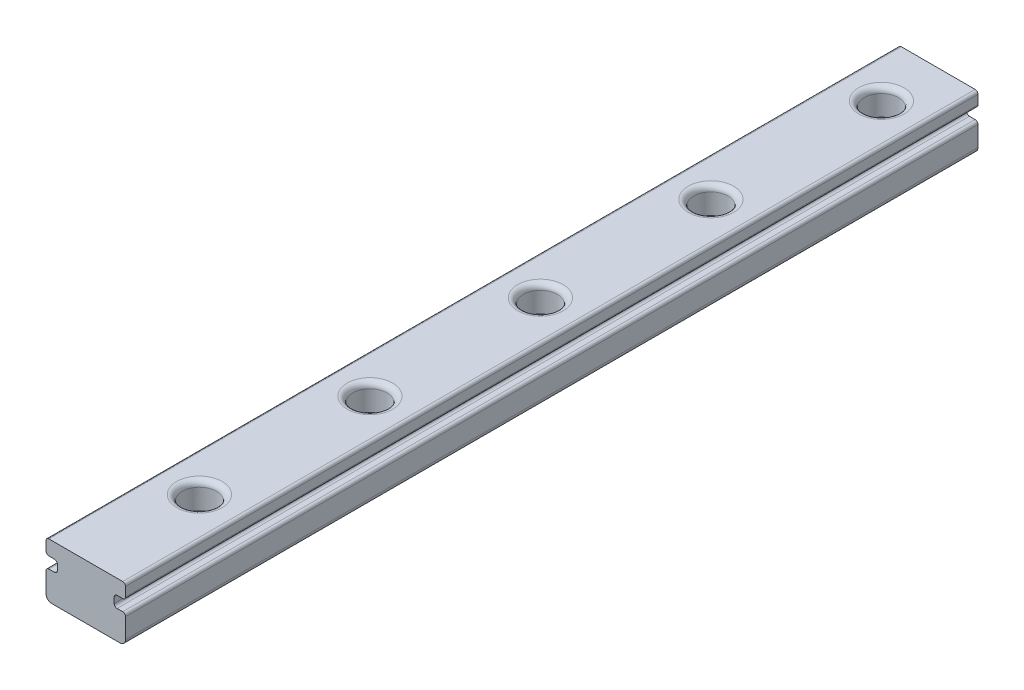
from build123d import *

# Parameters (mm, degrees)
EXTRUDE_1_DEPTH                = 85
FILLET_1_R                     = 0.25
FILLET_2_R                     = 0.5
SKETCH_2_R                     = 1.5
CUT_EXTRUDE_1_DEPTH            = 2.3
SKETCH_3_R                     = 1.2
CUT_EXTRUDE_2_DEPTH            = 86.324381041
FILLET_3_R                     = 0.5
PATTERN_LINEAR_2_COUNT         = 6
PATTERN_LINEAR_2_PITCH         = 15
FILLET_3_OF_PATTERN_LINEAR_2_R = 0.5
SKETCH_4_W                     = 7
SKETCH_4_H                     = 10
CUT_EXTRUDE_3_DEPTH            = 86.422713607


with BuildPart() as part:
    # 草图1 → 凸台-拉伸1 (new body)
    with BuildSketch(Plane.XY):
        Polygon((0, 2.5), (0, 0), (7, 0), (7, 2.5), (6, 2.5), (6, 3.5), (7, 3.5), (7, 4.8), (0, 4.8), (0, 3.5), (1, 3.5), (1, 2.5), align=None)
    extrude(amount=EXTRUDE_1_DEPTH)

    # 圆角1
    fillet_1_edges = [part.edges().sort_by_distance(p)[0] for p in [
        (7, 2.5, 42.5),
        (0, 2.5, 42.5),
        (1, 3.5, 42.5),
        (1, 2.5, 42.5),
        (6, 2.5, 42.5),
        (6, 3.5, 42.5),
        (7, 4.8, 42.5),
        (0, 4.8, 42.5),
        (0, 3.5, 42.5),
        (7, 3.5, 42.5),
    ]]
    fillet(fillet_1_edges, radius=FILLET_1_R)

    # 圆角2
    fillet_2_edges = [part.edges().sort_by_distance(p)[0] for p in [
        (0, 0, 42.5),
        (7, 0, 42.5),
    ]]
    fillet(fillet_2_edges, radius=FILLET_2_R)

    # 草图2 → 切除-拉伸1 (cut)
    with BuildSketch(Plane(origin=(0, 4.8, 0), x_dir=(1, 0, 0), z_dir=(0, 1, 0))):
        with Locations((3.5, -5)):
            Circle(SKETCH_2_R)
    cut_extrude_1 = extrude(amount=-CUT_EXTRUDE_1_DEPTH, mode=Mode.SUBTRACT)

    # 草图3 → 切除-拉伸2 (cut, through all)
    with BuildSketch(Plane(origin=(0, 2.5, 0), x_dir=(1, 0, 0), z_dir=(0, 1, 0))):
        with Locations((3.5, -5)):
            Circle(SKETCH_3_R)
    cut_extrude_2 = extrude(amount=-CUT_EXTRUDE_2_DEPTH, mode=Mode.SUBTRACT)

    # 圆角3
    fillet_3_edges = [part.edges().sort_by_distance(p)[0] for p in [
        (2, 4.8, 5),
    ]]
    fillet(fillet_3_edges, radius=FILLET_3_R)

    # 阵列(线性)2: 切除-拉伸1, 切除-拉伸2 ×6
    with Locations(*[(0, 0, i * PATTERN_LINEAR_2_PITCH) for i in range(1, PATTERN_LINEAR_2_COUNT)]):
        add(cut_extrude_1, mode=Mode.SUBTRACT)
        add(cut_extrude_2, mode=Mode.SUBTRACT)

    # 圆角3 of 阵列(线性)2
    fillet_3_of_pattern_linear_2_edges = [part.edges().sort_by_distance(p)[0] for p in [
        (2, 4.8, 20),
        (2, 4.8, 35),
        (2, 4.8, 50),
        (2, 4.8, 65),
        (2, 4.8, 80),
    ]]
    fillet(fillet_3_of_pattern_linear_2_edges, radius=FILLET_3_OF_PATTERN_LINEAR_2_R)

    # 草图4 → 切除-拉伸3 (cut, through all)
    with BuildSketch(Plane.XZ):
        with Locations((3.5, 80)):
            Rectangle(SKETCH_4_W, SKETCH_4_H)
    extrude(amount=-CUT_EXTRUDE_3_DEPTH, mode=Mode.SUBTRACT)


solid = part.part
